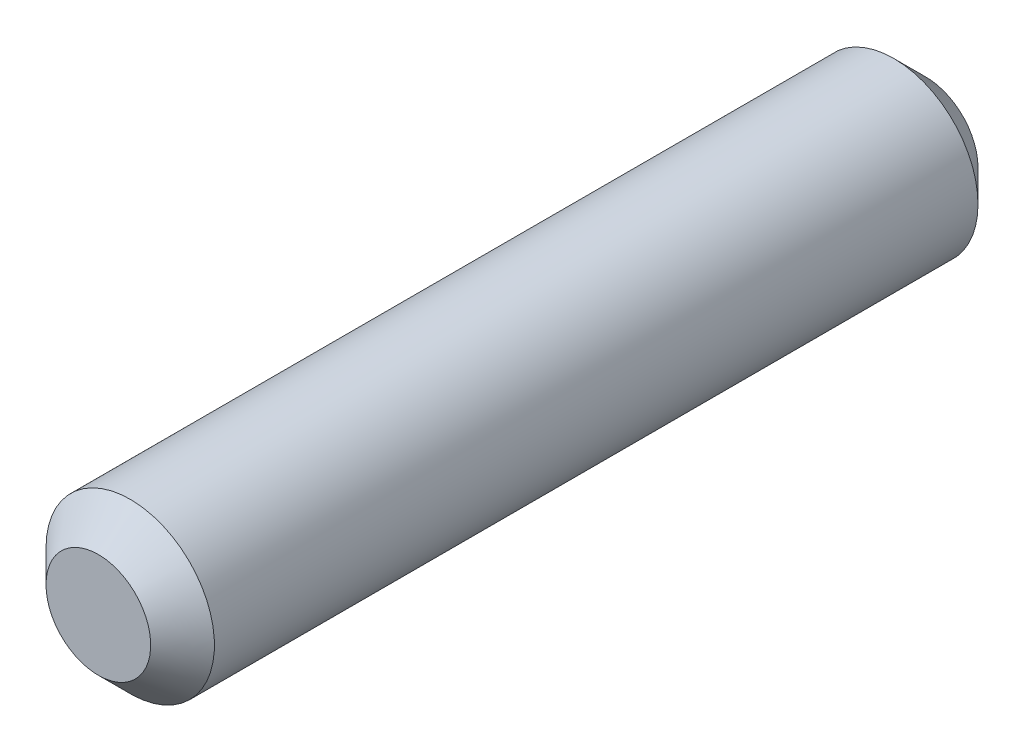
from build123d import *

# Parameters (mm, degrees)
SKETCH1_R           = 1.585
BOSS_EXTRUDE1_DEPTH = 7.785
CHAMFER1_SIZE       = 0.6


with BuildPart() as part:
    # Sketch1 → Boss-Extrude1 (new, symmetric)
    with BuildSketch(Plane.XY):
        Circle(SKETCH1_R)
    extrude(amount=BOSS_EXTRUDE1_DEPTH, both=True)

    # Chamfer1
    chamfer1_edges = [part.edges().sort_by_distance(p)[0] for p in [
        (-1.585, 0, -7.785),
        (-1.585, 0, 7.785),
    ]]
    chamfer(chamfer1_edges, length=CHAMFER1_SIZE)


solid = part.part
